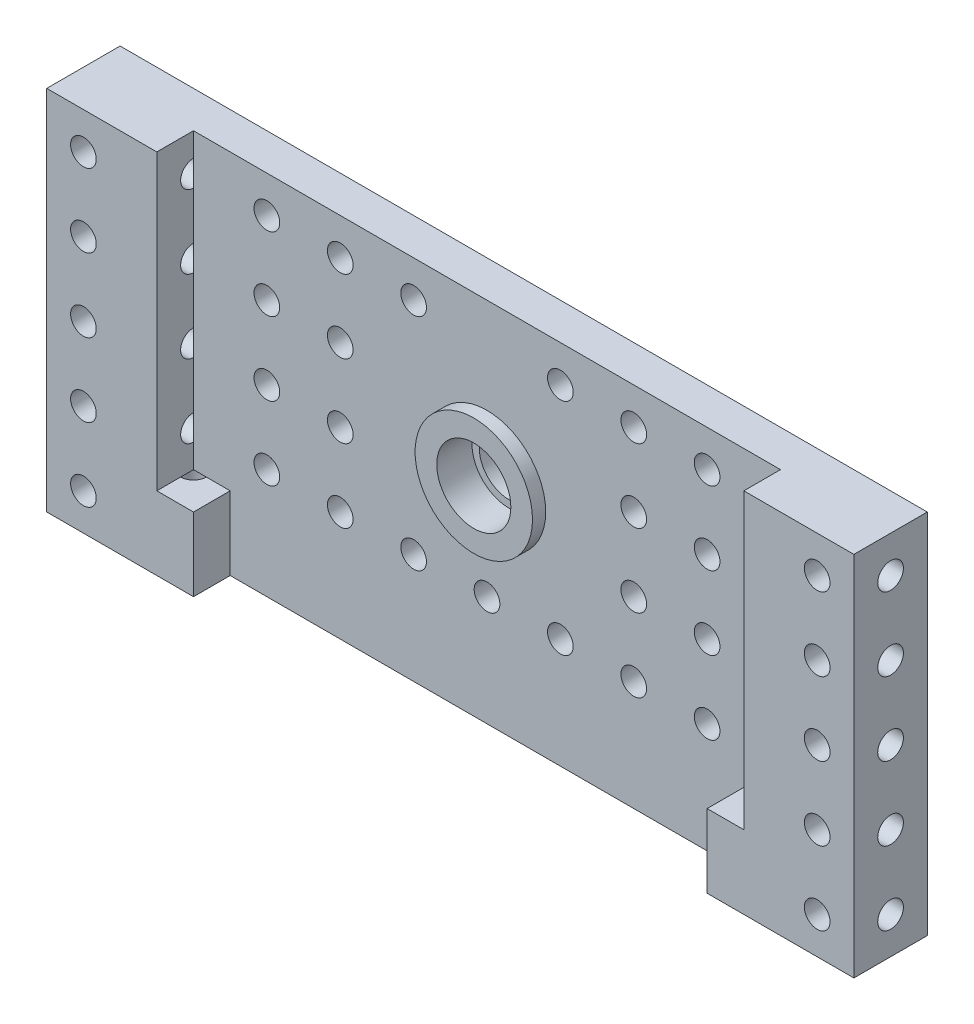
from build123d import *

# Parameters (mm, degrees)
ESQUISSE1_W             = 90
ESQUISSE1_H             = 40
ESQUISSE1_R             = 5.05
ESQUISSE1_R_2           = 1.75
BOSS_EXTRU_1_DEPTH      = 10
ESQUISSE3_W             = 80
ESQUISSE3_H             = 40
ENL_V_MAT_EXTRU_3_DEPTH = 5
ESQUISSE4_R             = 1.75
BOSS_EXTRU_2_DEPTH      = 10
ESQUISSE2_R             = 1.75
ENL_V_MAT_EXTRU_1_DEPTH = 5
ENL_V_START             = -85
ESQUISSE2_2_R           = 1.75
ENL_V_MAT_EXTRU_2_DEPTH = 5
BOSS_EXTRU_3_START      = 10
ESQUISSE5_W             = 10
ESQUISSE5_H             = 50
ESQUISSE5_R             = 1.75
BOSS_EXTRU_3_DEPTH      = 10
BOSS_EXTRU_4_START      = -100
ESQUISSE5_2_W           = 10
ESQUISSE5_2_H           = 50
ESQUISSE5_2_R           = 1.75
BOSS_EXTRU_4_DEPTH      = 10
ESQUISSE6_R             = 1.75
ENL_V_MAT_EXTRU_4_DEPTH = 10
ESQUISSE7_R             = 5.05
ESQUISSE7_R_2           = 4.05
BOSS_EXTRU_5_DEPTH      = 2
ESQUISSE8_R             = 8
ESQUISSE8_R_2           = 5.05
BOSS_EXTRU_6_DEPTH      = 1.8


with BuildPart() as part:
    # Esquisse1 → Boss.-Extru.1 (new body)
    with BuildSketch(Plane.XY):
        with Locations((45, 20)):
            Rectangle(ESQUISSE1_W, ESQUISSE1_H)
        with Locations((45, 19)):
            Circle(ESQUISSE1_R, mode=Mode.SUBTRACT)
        with Locations((15, 35)):
            Circle(ESQUISSE1_R_2, mode=Mode.SUBTRACT)
        with Locations((25, 35)):
            Circle(ESQUISSE1_R_2, mode=Mode.SUBTRACT)
        with Locations((35, 35)):
            Circle(ESQUISSE1_R_2, mode=Mode.SUBTRACT)
        with Locations((55, 35)):
            Circle(ESQUISSE1_R_2, mode=Mode.SUBTRACT)
        with Locations((65, 35)):
            Circle(ESQUISSE1_R_2, mode=Mode.SUBTRACT)
        with Locations((75, 35)):
            Circle(ESQUISSE1_R_2, mode=Mode.SUBTRACT)
        with Locations((15, 25)):
            Circle(ESQUISSE1_R_2, mode=Mode.SUBTRACT)
        with Locations((25, 25)):
            Circle(ESQUISSE1_R_2, mode=Mode.SUBTRACT)
        with Locations((65, 25)):
            Circle(ESQUISSE1_R_2, mode=Mode.SUBTRACT)
        with Locations((75, 25)):
            Circle(ESQUISSE1_R_2, mode=Mode.SUBTRACT)
        with Locations((15, 15)):
            Circle(ESQUISSE1_R_2, mode=Mode.SUBTRACT)
        with Locations((25, 15)):
            Circle(ESQUISSE1_R_2, mode=Mode.SUBTRACT)
        with Locations((65, 15)):
            Circle(ESQUISSE1_R_2, mode=Mode.SUBTRACT)
        with Locations((75, 15)):
            Circle(ESQUISSE1_R_2, mode=Mode.SUBTRACT)
        with Locations((15, 5)):
            Circle(ESQUISSE1_R_2, mode=Mode.SUBTRACT)
        with Locations((25, 5)):
            Circle(ESQUISSE1_R_2, mode=Mode.SUBTRACT)
        with Locations((35, 5)):
            Circle(ESQUISSE1_R_2, mode=Mode.SUBTRACT)
        with Locations((45, 5)):
            Circle(ESQUISSE1_R_2, mode=Mode.SUBTRACT)
        with Locations((55, 5)):
            Circle(ESQUISSE1_R_2, mode=Mode.SUBTRACT)
        with Locations((65, 5)):
            Circle(ESQUISSE1_R_2, mode=Mode.SUBTRACT)
        with Locations((75, 5)):
            Circle(ESQUISSE1_R_2, mode=Mode.SUBTRACT)
    extrude(amount=BOSS_EXTRU_1_DEPTH)

    # Esquisse3 → Enlèv. mat.-Extru.3 (cut)
    with BuildSketch(Plane.XY.offset(10)):
        with Locations((45, 20)):
            Rectangle(ESQUISSE3_W, ESQUISSE3_H)
    extrude(amount=-ENL_V_MAT_EXTRU_3_DEPTH, mode=Mode.SUBTRACT)

    # Esquisse4 → Boss.-Extru.2 (add)
    with BuildSketch(Plane.XZ):
        Polygon((0, 0), (0, 10), (10, 10), (10, 5), (80, 5), (80, 10), (90, 10), (90, 0), align=None)
        with Locations((5, 5)):
            Circle(ESQUISSE4_R, mode=Mode.SUBTRACT)
        with Locations(Location((85, 5, 0), (0, 0, 180))):
            Circle(ESQUISSE4_R, mode=Mode.SUBTRACT)
    extrude(amount=BOSS_EXTRU_2_DEPTH)

    # Esquisse2 → Enlèv. mat.-Extru.1 (cut)
    with BuildSketch(Plane(origin=(90, 0, 0), x_dir=(0, 0, -1), z_dir=(1, 0, 0))):
        with Locations(Location((-5, 35, 0), (0, 0, 90))):
            Circle(ESQUISSE2_R)
        with Locations(Location((-5, 25, 0), (0, 0, 90))):
            Circle(ESQUISSE2_R)
        with Locations(Location((-5, 15, 0), (0, 0, 90))):
            Circle(ESQUISSE2_R)
        with Locations(Location((-5, 5, 0), (0, 0, 90))):
            Circle(ESQUISSE2_R)
        with Locations(Location((-5, -5, 0), (0, 0, 90))):
            Circle(ESQUISSE2_R)
    extrude(amount=-ENL_V_MAT_EXTRU_1_DEPTH, mode=Mode.SUBTRACT)

    # Esquisse2<2> → Enlèv. mat.-Extru.2 (cut)
    with BuildSketch(Plane(origin=(90, 0, 0), x_dir=(0, 0, -1), z_dir=(1, 0, 0)).offset(ENL_V_START)):
        with Locations(Location((-5, 35, 0), (0, 0, 90))):
            Circle(ESQUISSE2_2_R)
        with Locations(Location((-5, 25, 0), (0, 0, 90))):
            Circle(ESQUISSE2_2_R)
        with Locations(Location((-5, 15, 0), (0, 0, 90))):
            Circle(ESQUISSE2_2_R)
        with Locations(Location((-5, 5, 0), (0, 0, 90))):
            Circle(ESQUISSE2_2_R)
        with Locations(Location((-5, -5, 0), (0, 0, 90))):
            Circle(ESQUISSE2_2_R)
    extrude(amount=-ENL_V_MAT_EXTRU_2_DEPTH, mode=Mode.SUBTRACT)

    # Esquisse5 → Boss.-Extru.3 (add)
    with BuildSketch(Plane(origin=(90, 0, 0), x_dir=(0, 0, -1), z_dir=(1, 0, 0)).offset(BOSS_EXTRU_3_START)):
        with Locations((-5, 15)):
            Rectangle(ESQUISSE5_W, ESQUISSE5_H)
        with Locations(Location((-5, 35, 0), (0, 0, 90))):
            Circle(ESQUISSE5_R, mode=Mode.SUBTRACT)
        with Locations(Location((-5, 25, 0), (0, 0, 90))):
            Circle(ESQUISSE5_R, mode=Mode.SUBTRACT)
        with Locations(Location((-5, 15, 0), (0, 0, 90))):
            Circle(ESQUISSE5_R, mode=Mode.SUBTRACT)
        with Locations(Location((-5, 5, 0), (0, 0, 90))):
            Circle(ESQUISSE5_R, mode=Mode.SUBTRACT)
        with Locations(Location((-5, -5, 0), (0, 0, 90))):
            Circle(ESQUISSE5_R, mode=Mode.SUBTRACT)
    extrude(amount=-BOSS_EXTRU_3_DEPTH)

    # Esquisse5<2> → Boss.-Extru.4 (add)
    with BuildSketch(Plane(origin=(90, 0, 0), x_dir=(0, 0, -1), z_dir=(1, 0, 0)).offset(BOSS_EXTRU_4_START)):
        with Locations((-5, 15)):
            Rectangle(ESQUISSE5_2_W, ESQUISSE5_2_H)
        with Locations(Location((-5, 35, 0), (0, 0, 90))):
            Circle(ESQUISSE5_2_R, mode=Mode.SUBTRACT)
        with Locations(Location((-5, 25, 0), (0, 0, 90))):
            Circle(ESQUISSE5_2_R, mode=Mode.SUBTRACT)
        with Locations(Location((-5, 15, 0), (0, 0, 90))):
            Circle(ESQUISSE5_2_R, mode=Mode.SUBTRACT)
        with Locations(Location((-5, 5, 0), (0, 0, 90))):
            Circle(ESQUISSE5_2_R, mode=Mode.SUBTRACT)
        with Locations(Location((-5, -5, 0), (0, 0, 90))):
            Circle(ESQUISSE5_2_R, mode=Mode.SUBTRACT)
    extrude(amount=BOSS_EXTRU_4_DEPTH)

    # Esquisse6 → Enlèv. mat.-Extru.4 (cut)
    with BuildSketch(Plane(origin=(0, 0, 0), x_dir=(-1, 0, 0), z_dir=(0, 0, -1))):
        with Locations((-95, 35)):
            Circle(ESQUISSE6_R)
        with Locations((5, 35)):
            Circle(ESQUISSE6_R)
        with Locations((5, 25)):
            Circle(ESQUISSE6_R)
        with Locations((5, 15)):
            Circle(ESQUISSE6_R)
        with Locations((5, 5)):
            Circle(ESQUISSE6_R)
        with Locations((5, -5)):
            Circle(ESQUISSE6_R)
        with Locations((-95, 25)):
            Circle(ESQUISSE6_R)
        with Locations((-95, 15)):
            Circle(ESQUISSE6_R)
        with Locations((-95, 5)):
            Circle(ESQUISSE6_R)
        with Locations((-95, -5)):
            Circle(ESQUISSE6_R)
    extrude(amount=-ENL_V_MAT_EXTRU_4_DEPTH, mode=Mode.SUBTRACT)

    # Esquisse7 → Boss.-Extru.5 (add)
    with BuildSketch(Plane(origin=(0, 0, 0), x_dir=(-1, 0, 0), z_dir=(0, 0, -1))):
        with Locations(Location((-45, 19, 0), (0, 0, 180))):
            Circle(ESQUISSE7_R)
        with Locations((-45, 19)):
            Circle(ESQUISSE7_R_2, mode=Mode.SUBTRACT)
    extrude(amount=-BOSS_EXTRU_5_DEPTH)

    # Esquisse8 → Boss.-Extru.6 (add)
    with BuildSketch(Plane.XY.offset(5)):
        with Locations((45, 19)):
            Circle(ESQUISSE8_R)
        with Locations((45, 19)):
            Circle(ESQUISSE8_R_2, mode=Mode.SUBTRACT)
    extrude(amount=BOSS_EXTRU_6_DEPTH)


solid = part.part
